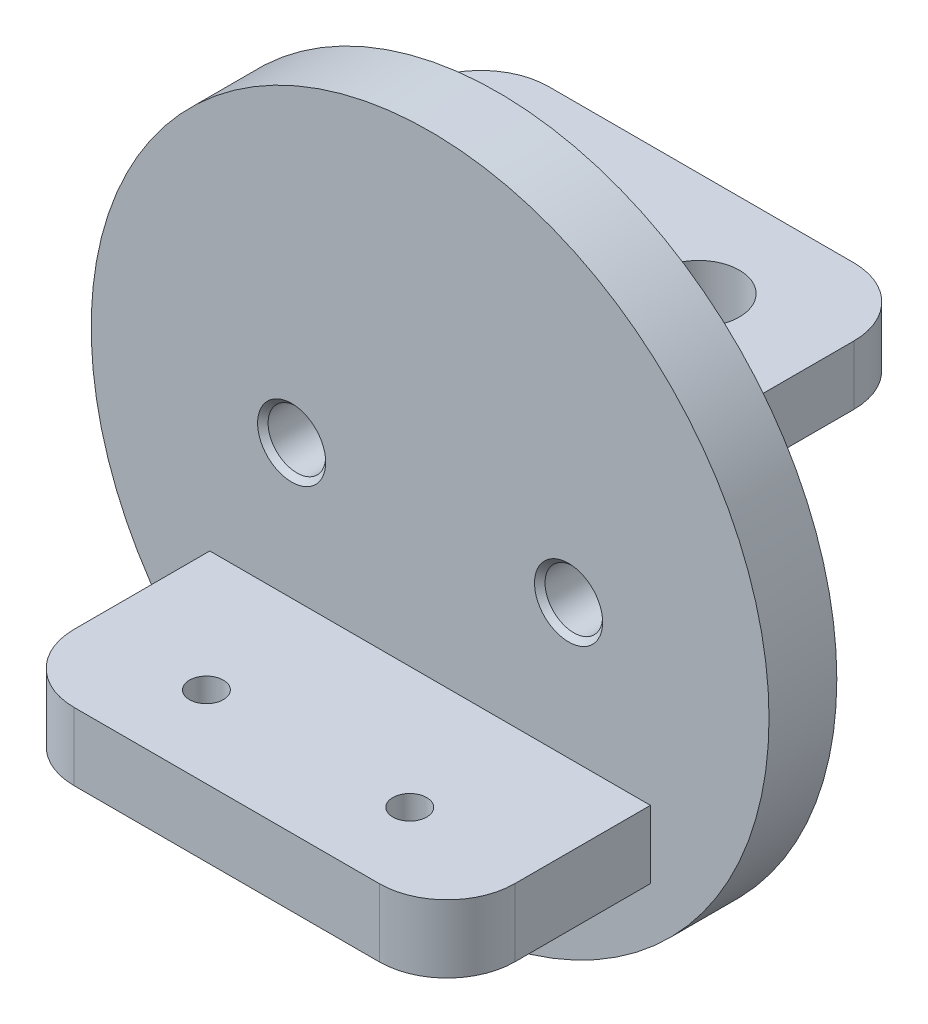
from build123d import *

# Parameters (mm, degrees)
SKETCH_1_R                    = 50
EXTRUDE_1_DEPTH               = 10
HOLE_WIZARD_M10_1_D           = 8.5
HOLE_WIZARD_M10_1_CSINK_D     = 10.05
HOLE_WIZARD_M10_1_CSINK_ANGLE = 90
SKETCH_16_W                   = 65
SKETCH_16_H                   = 10
EXTRUDE_2_DEPTH               = 30
SKETCH_18_W                   = 65
SKETCH_18_H                   = 8.750492466
EXTRUDE_3_DEPTH               = 40
FILLET_2_R                    = 10
FILLET_3_R                    = 10
CUT_EXTRUDE_1_REACH           = 104.364
SKETCH_20_R                   = 2.5
CUT_EXTRUDE_2_REACH           = 100.203
SKETCH_22_R                   = 6


with BuildPart() as part:
    # 草图1 → 凸台-拉伸1 (new body)
    with BuildSketch(Plane.XY):
        Circle(SKETCH_1_R)
    extrude(amount=EXTRUDE_1_DEPTH)

    # M10 螺纹孔1 (through all)
    with Locations(Plane.XY.offset(10)):
        with Locations((-20.426671729, 0)):
            hole_wizard_m10_1 = CounterSinkHole(HOLE_WIZARD_M10_1_D / 2, HOLE_WIZARD_M10_1_CSINK_D / 2, counter_sink_angle=HOLE_WIZARD_M10_1_CSINK_ANGLE)

    # 镜向2: M10 螺纹孔1 across plane
    add(hole_wizard_m10_1.mirror(Plane(origin=(0, 0, 0), x_dir=(0, 0, 1), z_dir=(1, 0, 0))), mode=Mode.SUBTRACT)

    # 草图16 → 凸台-拉伸2 (add)
    with BuildSketch(Plane.XY.offset(10)):
        with Locations((0, -24.864937428)):
            Rectangle(SKETCH_16_W, SKETCH_16_H)
    extrude(amount=EXTRUDE_2_DEPTH)

    # 草图18 → 凸台-拉伸3 (add)
    with BuildSketch(Plane.XY.offset(10)):
        with Locations((0, 20.081420938)):
            Rectangle(SKETCH_18_W, SKETCH_18_H)
    extrude(amount=-EXTRUDE_3_DEPTH)

    # 圆角2
    fillet_2_edges = [part.edges().sort_by_distance(p)[0] for p in [
        (-32.5, -24.864937428, 40),
        (32.5, -24.864937428, 40),
    ]]
    fillet(fillet_2_edges, radius=FILLET_2_R)

    # 圆角3
    fillet_3_edges = [part.edges().sort_by_distance(p)[0] for p in [
        (32.5, 20.081420938, -30),
        (-32.5, 20.081420938, -30),
    ]]
    fillet(fillet_3_edges, radius=FILLET_3_R)

    # 草图20 → 切除-拉伸1 (cut, up to next)
    with BuildSketch(Plane.XZ.offset(29.864937428), mode=Mode.PRIVATE) as cut_extrude_1_sk1:
        with Locations(Location((-15, 28, 0), (0, 0, 270))):
            Circle(SKETCH_20_R)
    cut_extrude_1_tool1 = extrude(cut_extrude_1_sk1.sketch, amount=-CUT_EXTRUDE_1_REACH, mode=Mode.PRIVATE) & part.part
    # 草图20 → 切除-拉伸1 (cut, up to next)
    with BuildSketch(Plane.XZ.offset(29.864937428), mode=Mode.PRIVATE) as cut_extrude_1_sk2:
        with Locations(Location((15, 28, 0), (0, 0, 90))):
            Circle(SKETCH_20_R)
    cut_extrude_1_tool2 = extrude(cut_extrude_1_sk2.sketch, amount=-CUT_EXTRUDE_1_REACH, mode=Mode.PRIVATE) & part.part
    add(cut_extrude_1_tool1.solids().sort_by_distance((-15, -29.864937, 28))[0], mode=Mode.SUBTRACT)
    add(cut_extrude_1_tool2.solids().sort_by_distance((15, -29.864937, 28))[0], mode=Mode.SUBTRACT)

    # 草图22 → 切除-拉伸2 (cut, up to next)
    with BuildSketch(Plane(origin=(0, 24.456667171, 0), x_dir=(1, 0, 0), z_dir=(0, 1, 0)), mode=Mode.PRIVATE) as cut_extrude_2_sk1:
        with Locations(Location((-15, 14.615729017, 0), (0, 0, 270))):
            Circle(SKETCH_22_R)
    cut_extrude_2_tool1 = extrude(cut_extrude_2_sk1.sketch, amount=-CUT_EXTRUDE_2_REACH, mode=Mode.PRIVATE) & part.part
    # 草图22 → 切除-拉伸2 (cut, up to next)
    with BuildSketch(Plane(origin=(0, 24.456667171, 0), x_dir=(1, 0, 0), z_dir=(0, 1, 0)), mode=Mode.PRIVATE) as cut_extrude_2_sk2:
        with Locations(Location((15, 14.615729017, 0), (0, 0, 90))):
            Circle(SKETCH_22_R)
    cut_extrude_2_tool2 = extrude(cut_extrude_2_sk2.sketch, amount=-CUT_EXTRUDE_2_REACH, mode=Mode.PRIVATE) & part.part
    add(cut_extrude_2_tool1.solids().sort_by_distance((-15, 24.456667, -14.615729))[0], mode=Mode.SUBTRACT)
    add(cut_extrude_2_tool2.solids().sort_by_distance((15, 24.456667, -14.615729))[0], mode=Mode.SUBTRACT)


solid = part.part
